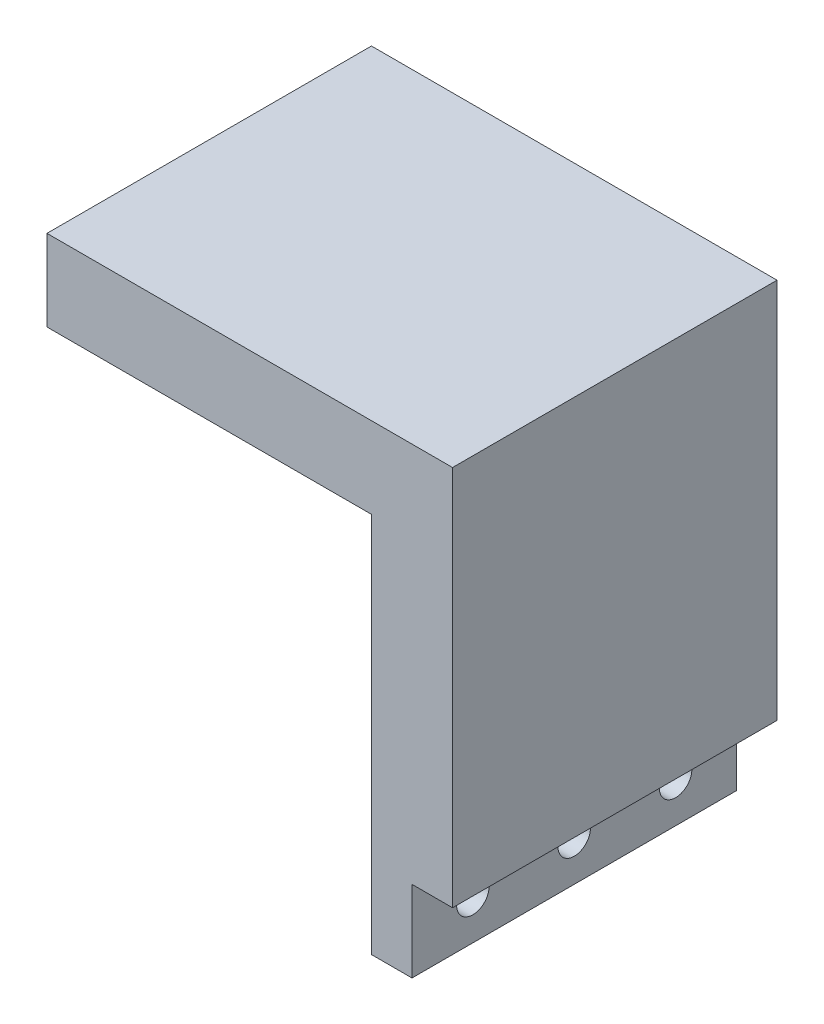
from build123d import *

# Parameters (mm, degrees)
BOSS_EXTRUDE1_DEPTH      = 20
SKETCH2_R                = 5.1
SKETCH2_R_2              = 1.75
CUT_EXTRUDE1_DEPTH       = 98.821265582
CUT_EXTRUDE2_DEPTH       = 109.023145668
F_4_0_4_DIAMETER_HOLE1_D = 4


with BuildPart() as part:
    # Sketch1 → Boss-Extrude1 (new, symmetric)
    with BuildSketch(Plane.XY):
        Polygon((0, 0), (0, 87), (-50, 87), (-50, 77), (-10, 77), (-10, 0), align=None)
    extrude(amount=BOSS_EXTRUDE1_DEPTH, both=True)

    # Sketch2 → Cut-Extrude1 (cut, through all)
    with BuildSketch(Plane.ZY.offset(10)):
        with Locations(Location((0, 11, 0), (0, 0, 270))):
            Circle(SKETCH2_R)
        with Locations(Location((5.656854249, 16.656854249, 0), (0, 0, 270))):
            Circle(SKETCH2_R_2)
        with Locations(Location((5.656854249, 5.343145751, 0), (0, 0, 270))):
            Circle(SKETCH2_R_2)
        with Locations(Location((-5.656854249, 16.656854249, 0), (0, 0, 270))):
            Circle(SKETCH2_R_2)
        with Locations(Location((-5.656854249, 5.343145751, 0), (0, 0, 270))):
            Circle(SKETCH2_R_2)
    extrude(amount=-CUT_EXTRUDE1_DEPTH, mode=Mode.SUBTRACT)

    # Sketch3 → Cut-Extrude2 (cut, through all)
    with BuildSketch(Plane.XY.offset(20)):
        Polygon((0, 0), (-10, 0), (-10, 30), (-5, 30), (-5, 40), (0, 40), align=None)
    extrude(amount=-CUT_EXTRUDE2_DEPTH, mode=Mode.SUBTRACT)

    # Ø4.0 (4) Diameter Hole1 (through all)
    with Locations(Plane(origin=(-5, 0, 0), x_dir=(0, 0, -1), z_dir=(1, 0, 0))):
        with Locations((-12.5, 35), (0, 35), (12.5, 35)):
            Hole(F_4_0_4_DIAMETER_HOLE1_D / 2)


solid = part.part
